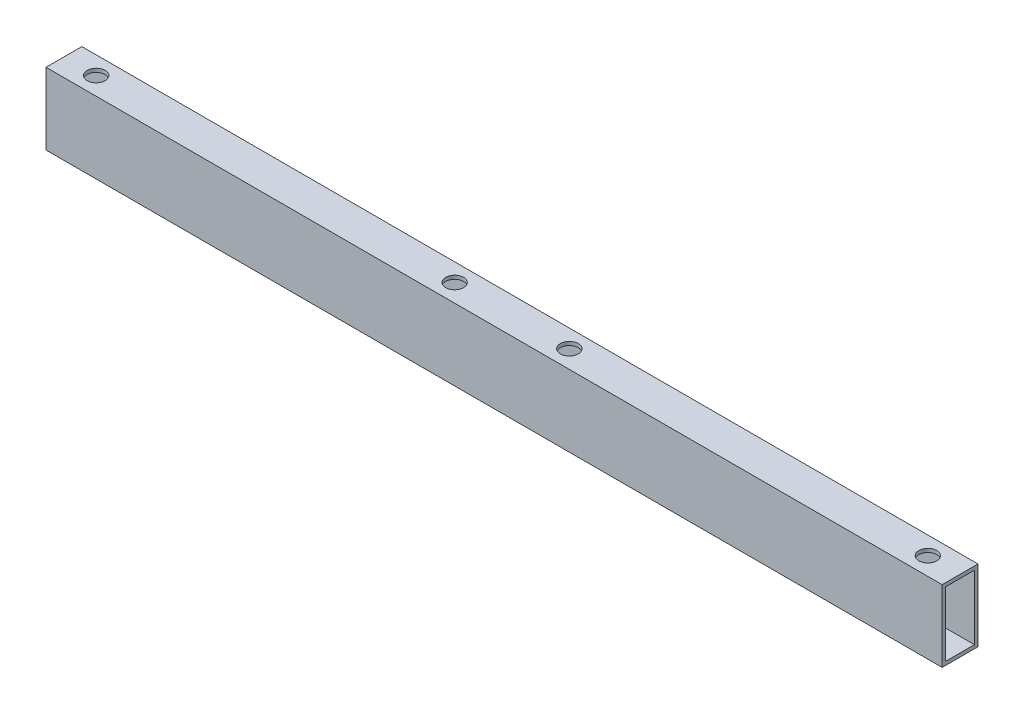
from build123d import *

# Parameters (mm, degrees)
SKETCH1_W           = 10
SKETCH1_H           = 20
SKETCH1_W_2         = 8
SKETCH1_H_2         = 18
BOSS_EXTRUDE1_DEPTH = 250
SKETCH2_R           = 2.5
CUT_EXTRUDE1_DEPTH  = 20
SKETCH3_R           = 2.5
CUT_EXTRUDE2_DEPTH  = 20


with BuildPart() as part:
    # Sketch1 → Boss-Extrude1 (new body)
    with BuildSketch(Plane(origin=(0, 0, 0), x_dir=(0, 0, -1), z_dir=(1, 0, 0))):
        Rectangle(SKETCH1_W, SKETCH1_H)
        Rectangle(SKETCH1_W_2, SKETCH1_H_2, mode=Mode.SUBTRACT)
    extrude(amount=BOSS_EXTRUDE1_DEPTH)

    # Sketch2 → Cut-Extrude1 (cut)
    with BuildSketch(Plane(origin=(0, 10, 0), x_dir=(1, 0, 0), z_dir=(0, 1, 0))):
        with Locations(Location((241, 0, 0), (0, 0, 270))):
            Circle(SKETCH2_R)
        with Locations(Location((9, 0, 0), (0, 0, 270))):
            Circle(SKETCH2_R)
    extrude(amount=-CUT_EXTRUDE1_DEPTH, mode=Mode.SUBTRACT)

    # Sketch3 → Cut-Extrude2 (cut)
    with BuildSketch(Plane(origin=(0, 10, 0), x_dir=(1, 0, 0), z_dir=(0, 1, 0))):
        with Locations(Location((109, 0, 0), (0, 0, 270))):
            Circle(SKETCH3_R)
        with Locations(Location((141, 0, 0), (0, 0, 270))):
            Circle(SKETCH3_R)
    extrude(amount=-CUT_EXTRUDE2_DEPTH, mode=Mode.SUBTRACT)


solid = part.part
